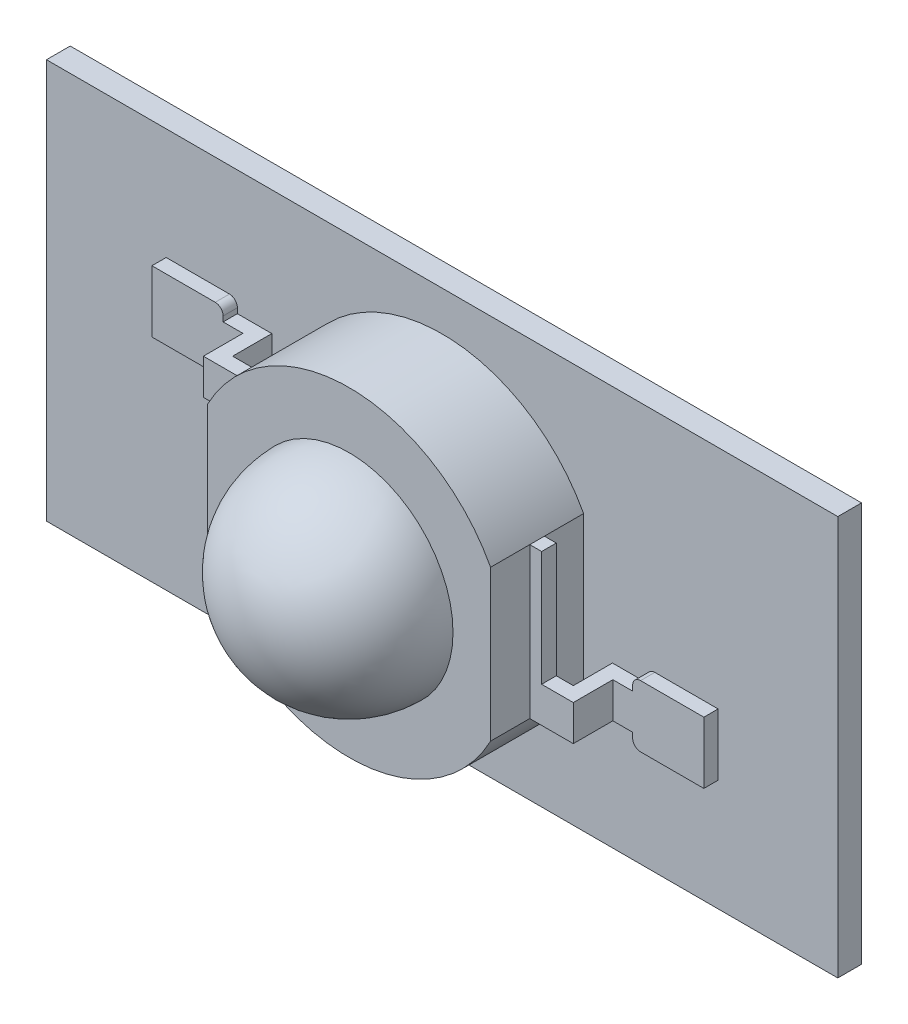
from build123d import *

# Parameters (mm, degrees)
SKETCH1_R            = 4.05
BOSS_EXTRUDE1_DEPTH  = 2.35
SKETCH2_R            = 1.5
SKETCH2_W            = 1
SKETCH2_H            = 1
BOSS_EXTRUDE2_DEPTH  = 0.2
REVOLVE1_ANGLE       = 180
SKETCH4_W            = 0.475
SKETCH4_H            = 8.1
CUT_EXTRUDE1_DEPTH   = 10.428845369
SKETCH5_W            = 0.37
SKETCH5_H            = 3.806244868
BOSS_EXTRUDE3_DEPTH  = 0.3
SKETCH6_W            = 0.37
SKETCH6_H            = 0.9
BOSS_EXTRUDE4_DEPTH  = 0.8
SKETCH7_W            = 0.37
SKETCH7_H            = 0.9
BOSS_EXTRUDE5_DEPTH  = 1
SKETCH8_W            = 0.5
SKETCH8_H            = 0.9
BOSS_EXTRUDE6_DEPTH  = 0.37
SKETCH9_W            = 0.37
SKETCH9_H            = 3.806244868
BOSS_EXTRUDE7_DEPTH  = 0.3
SKETCH10_W           = 0.37
SKETCH10_H           = 0.9
BOSS_EXTRUDE8_DEPTH  = 0.8
SKETCH11_W           = 0.37
SKETCH11_H           = 0.9
BOSS_EXTRUDE9_DEPTH  = 1
SKETCH12_W           = 0.5
SKETCH12_H           = 0.9
BOSS_EXTRUDE10_DEPTH = 0.37
SKETCH13_R           = 2.75
BOSS_EXTRUDE11_DEPTH = 0.1
SKETCH14_W           = 20
SKETCH14_H           = 10.1
BOSS_EXTRUDE13_DEPTH = 0.6


with BuildPart() as part:
    # Sketch1 → Boss-Extrude1 (new body)
    with BuildSketch(Plane.XY):
        with Locations((0, 4.05)):
            Circle(SKETCH1_R)
    extrude(amount=BOSS_EXTRUDE1_DEPTH)

    # Sketch2 → Boss-Extrude2 (add)
    with BuildSketch(Plane.XY.offset(2.35)):
        with Locations((0, 4.05)):
            Circle(SKETCH2_R)
        with Locations((0, 4.05)):
            Rectangle(SKETCH2_W, SKETCH2_H, mode=Mode.SUBTRACT)
    extrude(amount=BOSS_EXTRUDE2_DEPTH)

    # Sketch3 → Revolve1 (revolve)
    with BuildSketch(Plane.XY.offset(2.35)):
        with BuildLine():
            Line((-2.625, 4.05), (-2.5, 4.05))
            ThreePointArc((-2.5, 4.05), (0, 6.55), (2.5, 4.05))
            Line((2.5, 4.05), (2.625, 4.05))
            ThreePointArc((2.625, 4.05), (0, 6.675), (-2.625, 4.05))
        make_face()
    revolve(axis=Axis((0, 4.05, 2.35), (1, 0, 0)), revolution_arc=REVOLVE1_ANGLE)

    # Sketch4 → Cut-Extrude1 (cut, through all)
    with BuildSketch(Plane.XY.offset(2.35)):
        with Locations((-3.8125, 4.05)):
            Rectangle(SKETCH4_W, SKETCH4_H)
        with Locations((3.8125, 4.05)):
            Rectangle(SKETCH4_W, SKETCH4_H)
    extrude(amount=-CUT_EXTRUDE1_DEPTH, mode=Mode.SUBTRACT)

    # Sketch5 → Boss-Extrude3 (add)
    with BuildSketch(Plane.ZY.offset(3.575)):
        with Locations((1.175, 4.05)):
            Rectangle(SKETCH5_W, SKETCH5_H)
    extrude(amount=BOSS_EXTRUDE3_DEPTH)

    # Sketch6 → Boss-Extrude4 (add)
    with BuildSketch(Plane.ZY.offset(3.875)):
        with Locations((1.175, 5.503122434)):
            Rectangle(SKETCH6_W, SKETCH6_H)
    extrude(amount=BOSS_EXTRUDE4_DEPTH)

    # Sketch7 → Boss-Extrude5 (add)
    with BuildSketch(Plane(origin=(0, 0, 0.99), x_dir=(-1, 0, 0), z_dir=(0, 0, -1))):
        with Locations((4.49, 5.503122434)):
            Rectangle(SKETCH7_W, SKETCH7_H)
    extrude(amount=BOSS_EXTRUDE5_DEPTH)

    # Sketch8 → Boss-Extrude6 (add)
    with BuildSketch(Plane(origin=(0, 0, -0.01), x_dir=(-1, 0, 0), z_dir=(0, 0, -1))):
        with BuildLine():
            Line((5.175, 6.083122434), (5.175, 5.953122434))
            Line((5.175, 5.953122434), (5.175, 5.503122434))
            Line((5.175, 5.503122434), (6.975, 5.503122434))
            Line((6.975, 5.503122434), (6.975, 6.283122434))
            Line((6.975, 6.283122434), (5.375, 6.283122434))
            ThreePointArc((5.375, 6.283122434), (5.233578644, 6.224543791), (5.175, 6.083122434))
        make_face()
        with BuildLine():
            Line((6.975, 5.503122434), (5.175, 5.503122434))
            Line((5.175, 5.503122434), (5.175, 5.053122434))
            Line((5.175, 5.053122434), (5.175, 4.923122434))
            ThreePointArc((5.175, 4.923122434), (5.233578644, 4.781701078), (5.375, 4.723122434))
            Line((5.375, 4.723122434), (6.975, 4.723122434))
            Line((6.975, 4.723122434), (6.975, 5.503122434))
        make_face()
        with Locations((4.925, 5.503122434)):
            Rectangle(SKETCH8_W, SKETCH8_H)
    extrude(amount=-BOSS_EXTRUDE6_DEPTH)

    # Sketch9 → Boss-Extrude7 (add)
    with BuildSketch(Plane(origin=(3.575, 0, 0), x_dir=(0, 0, -1), z_dir=(1, 0, 0))):
        with Locations((-1.175, 4.05)):
            Rectangle(SKETCH9_W, SKETCH9_H)
    extrude(amount=BOSS_EXTRUDE7_DEPTH)

    # Sketch10 → Boss-Extrude8 (add)
    with BuildSketch(Plane(origin=(3.875, 0, 0), x_dir=(0, 0, -1), z_dir=(1, 0, 0))):
        with Locations((-1.175, 2.596877566)):
            Rectangle(SKETCH10_W, SKETCH10_H)
    extrude(amount=BOSS_EXTRUDE8_DEPTH)

    # Sketch11 → Boss-Extrude9 (add)
    with BuildSketch(Plane(origin=(0, 0, 0.99), x_dir=(-1, 0, 0), z_dir=(0, 0, -1))):
        with Locations((-4.49, 2.596877566)):
            Rectangle(SKETCH11_W, SKETCH11_H)
    extrude(amount=BOSS_EXTRUDE9_DEPTH)

    # Sketch12 → Boss-Extrude10 (add)
    with BuildSketch(Plane(origin=(0, 0, -0.01), x_dir=(-1, 0, 0), z_dir=(0, 0, -1))):
        with Locations((-4.925, 2.596877566)):
            Rectangle(SKETCH12_W, SKETCH12_H)
        with BuildLine():
            Line((-5.175, 2.016877566), (-5.175, 2.146877566))
            Line((-5.175, 2.146877566), (-5.175, 2.596877566))
            Line((-5.175, 2.596877566), (-6.975, 2.596877566))
            Line((-6.975, 2.596877566), (-6.975, 1.816877566))
            Line((-6.975, 1.816877566), (-5.375, 1.816877566))
            ThreePointArc((-5.375, 1.816877566), (-5.233578644, 1.875456209), (-5.175, 2.016877566))
        make_face()
        with BuildLine():
            Line((-6.975, 2.596877566), (-5.175, 2.596877566))
            Line((-5.175, 2.596877566), (-5.175, 3.046877566))
            Line((-5.175, 3.046877566), (-5.175, 3.176877566))
            ThreePointArc((-5.175, 3.176877566), (-5.233578644, 3.318298922), (-5.375, 3.376877566))
            Line((-5.375, 3.376877566), (-6.975, 3.376877566))
            Line((-6.975, 3.376877566), (-6.975, 2.596877566))
        make_face()
    extrude(amount=-BOSS_EXTRUDE10_DEPTH)

    # Sketch13 → Boss-Extrude11 (add)
    with BuildSketch(Plane(origin=(0, 0, 0), x_dir=(-1, 0, 0), z_dir=(0, 0, -1))):
        with Locations((0, 4.05)):
            Circle(SKETCH13_R)
    extrude(amount=BOSS_EXTRUDE11_DEPTH)

    # Sketch14 → Boss-Extrude13 (add)
    with BuildSketch(Plane(origin=(0, 0, 0), x_dir=(-1, 0, 0), z_dir=(0, 0, -1))):
        with Locations((0, 4.05)):
            Rectangle(SKETCH14_W, SKETCH14_H)
    extrude(amount=BOSS_EXTRUDE13_DEPTH)


solid = part.part
